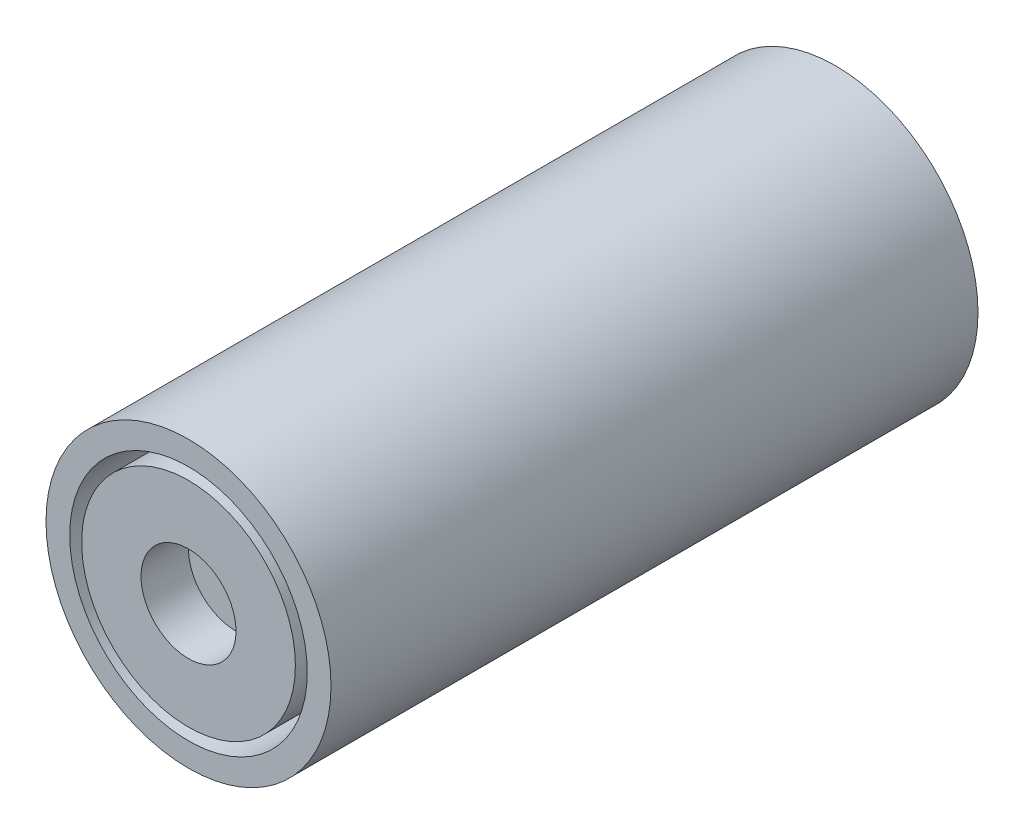
from build123d import *

# Parameters (mm, degrees)
SKETCH1_R           = 3.81
BOSS_EXTRUDE1_DEPTH = 17.2974
SKETCH1_6_R         = 3.175
SKETCH1_6_R_2       = 2.8575
CUT_EXTRUDE1_DEPTH  = 2.54
SKETCH1_7_R         = 1.27
CUT_EXTRUDE2_DEPTH  = 1.27


with BuildPart() as part:
    # Sketch1 → Boss-Extrude1 (new body)
    with BuildSketch(Plane.XY):
        Circle(SKETCH1_R)
    extrude(amount=-BOSS_EXTRUDE1_DEPTH)

    # Sketch1<6> → Cut-Extrude1 (cut)
    with BuildSketch(Plane.XY):
        Circle(SKETCH1_6_R)
        Circle(SKETCH1_6_R_2, mode=Mode.SUBTRACT)
    extrude(amount=-CUT_EXTRUDE1_DEPTH, mode=Mode.SUBTRACT)

    # Sketch1<7> → Cut-Extrude2 (cut)
    with BuildSketch(Plane.XY):
        Circle(SKETCH1_7_R)
    extrude(amount=-CUT_EXTRUDE2_DEPTH, mode=Mode.SUBTRACT)


solid = part.part
